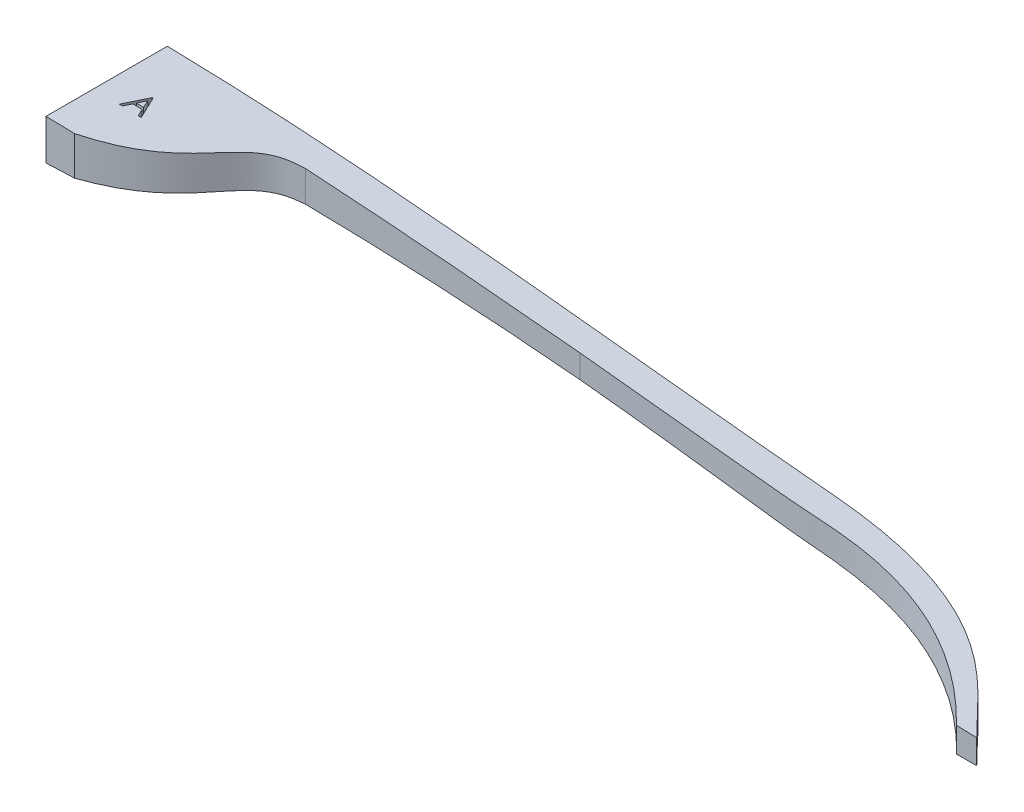
from build123d import *

# Parameters (mm, degrees)
SKETCH1_W           = 146.05
SKETCH1_H           = 19.05
BOSS_EXTRUDE1_DEPTH = 15.24
CUT_EXTRUDE5_DEPTH  = 1.905
CUT_EXTRUDE2_DEPTH  = 19.05
CUT_EXTRUDE3_DEPTH  = 149.073504166
SKETCH5_W           = 6.985
SKETCH5_H           = 3.81
CUT_EXTRUDE4_DEPTH  = 6.35


with BuildPart() as part:
    # Sketch1 → Boss-Extrude1 (new body)
    with BuildSketch(Plane(origin=(0, 0, 0), x_dir=(1, 0, 0), z_dir=(0, 1, 0))):
        with Locations((73.025, 9.525)):
            Rectangle(SKETCH1_W, SKETCH1_H)
    extrude(amount=BOSS_EXTRUDE1_DEPTH)

    # Sketch6 → Cut-Extrude5 (cut)
    with BuildSketch(Plane(origin=(0, 15.24, 0), x_dir=(1, 0, 0), z_dir=(0, 1, 0))):
        Polygon((5.792025279, 11.011495693), (7.429845792, 7.511495693), (6.969208773, 7.511495693), (6.437758452, 8.633290564), (5.006067747, 8.633290564), (4.474617426, 7.511495693), (4.019589382, 7.511495693), (5.65180092, 11.011495693), align=None)
        Polygon((5.7219131, 10.246571814), (5.177141465, 9.037136718), (6.272293709, 9.037136718), align=None, mode=Mode.SUBTRACT)
    extrude(amount=-CUT_EXTRUDE5_DEPTH, mode=Mode.SUBTRACT)

    # Sketch4 → Cut-Extrude2 (cut)
    with BuildSketch(Plane(origin=(0, 15.24, 0), x_dir=(1, 0, 0), z_dir=(0, 1, 0))):
        with BuildLine():
            add(Edge.make_bspline(
                [(4.476723392, 0), (17.725756487, 4.043101895), (17.090749047, 12.999753789), (25.262791442, 14.373397692), (26.219517358, 14.465775476)],
                knots=[0, 0, 0, 0, 0.256127126, 0.284585695, 0.284585695, 0.284585695, 0.284585695], degree=3))
            Line((4.476723392, 0), (142.875, 0))
            add(Edge.make_bspline(
                [(68.923918907, 14.861089556), (81.075041449, 14.855684794), (98.246564786, 14.797098309), (108.068516517, 14.713978549), (127.226778846, 16.049688466), (142.875, 0)],
                knots=[0.488488537, 0.488488537, 0.488488537, 0.488488537, 0.629203286, 0.700744717, 1, 1, 1, 1], degree=3))
            Line((68.923918907, 14.861089556), (26.219517358, 14.465775476))
        make_face()
        with BuildLine():
            add(Edge.make_bspline(
                [(105.157866441, 19.05), (131.491281961, 18.918345897), (139.296835945, 6.588803862), (146.05, 0)],
                knots=[0.010622627, 0.010622627, 0.010622627, 0.010622627, 1, 1, 1, 1], degree=3))
            Line((146.05, 0), (146.05, 19.05))
            Line((146.05, 19.05), (105.157866441, 19.05))
        make_face()
    extrude(amount=-CUT_EXTRUDE2_DEPTH, mode=Mode.SUBTRACT)

    # Sketch3 → Cut-Extrude3 (cut, through all)
    with BuildSketch(Plane(origin=(0, 0, -19.05), x_dir=(-1, 0, 0), z_dir=(0, 0, -1))):
        with BuildLine():
            Line((0, 0), (0, 8.89))
            add(Edge.make_bspline(
                [(0, 8.89), (-26.792555724, 10.094357911), (-71.276383534, 7.213998552), (-114.960678795, 0.591225669), (-132.239266272, 0)],
                knots=[0, 0, 0, 0, 0.551607579, 0.905919639, 0.905919639, 0.905919639, 0.905919639], degree=3))
            Line((-132.239266272, 0), (0, 0))
        make_face()
        with BuildLine():
            add(Edge.make_bspline(
                [(0, 15.24), (-48.91510465, 14.281311131), (-97.188371336, 5.218004406), (-146.05, 3.81)],
                knots=[0, 0, 0, 0, 1, 1, 1, 1], degree=3))
            Line((0, 15.24), (-146.05, 15.24))
            Line((-146.05, 15.24), (-146.05, 3.81))
        make_face()
    extrude(amount=-CUT_EXTRUDE3_DEPTH, mode=Mode.SUBTRACT)

    # Sketch5 → Cut-Extrude4 (cut)
    with BuildSketch(Plane.ZY):
        with Locations((-9.2075, 10.795)):
            Rectangle(SKETCH5_W, SKETCH5_H)
    extrude(amount=-CUT_EXTRUDE4_DEPTH, mode=Mode.SUBTRACT)


solid = part.part
